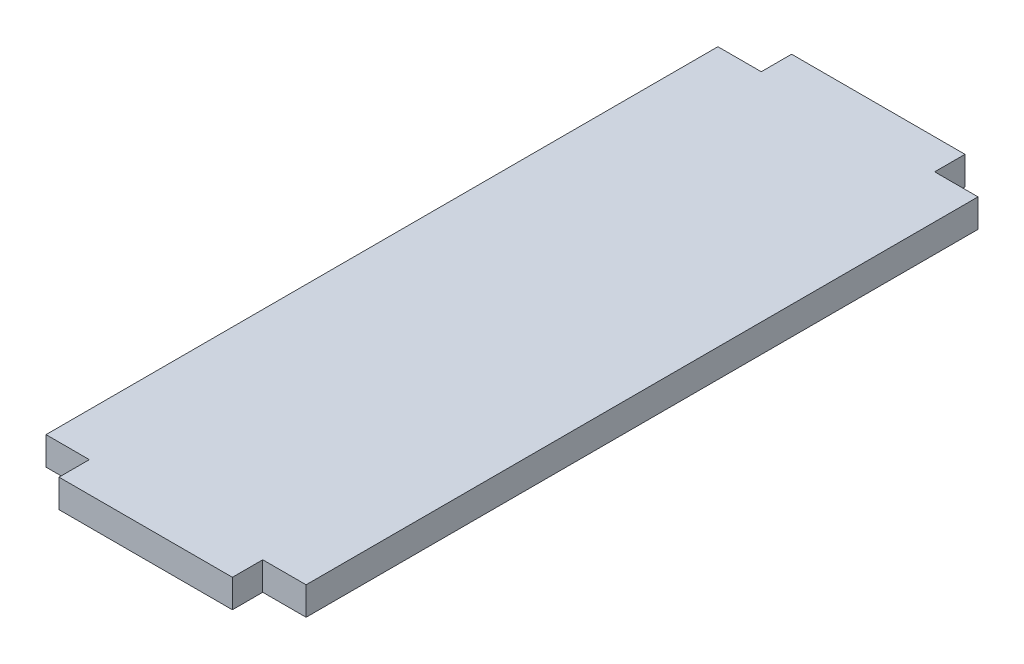
from build123d import *

# Parameters (mm, degrees)
SKETCH1_W           = 12
SKETCH1_H           = 31
BOSS_EXTRUDE1_DEPTH = 1.3
SKETCH2_W           = 8
SKETCH2_H           = 1.4
BOSS_EXTRUDE2_DEPTH = 1.3


with BuildPart() as part:
    # Sketch1 → Boss-Extrude1 (new body)
    with BuildSketch(Plane(origin=(0, 0, 0), x_dir=(1, 0, 0), z_dir=(0, 1, 0))):
        Rectangle(SKETCH1_W, SKETCH1_H)
    extrude(amount=BOSS_EXTRUDE1_DEPTH)

    # Sketch2 → Boss-Extrude2 (add)
    with BuildSketch(Plane(origin=(0, 1.3, 0), x_dir=(1, 0, 0), z_dir=(0, 1, 0))):
        with Locations((0, 16.2)):
            Rectangle(SKETCH2_W, SKETCH2_H)
        with Locations((0, -16.2)):
            Rectangle(SKETCH2_W, SKETCH2_H)
    extrude(amount=-BOSS_EXTRUDE2_DEPTH)


solid = part.part
